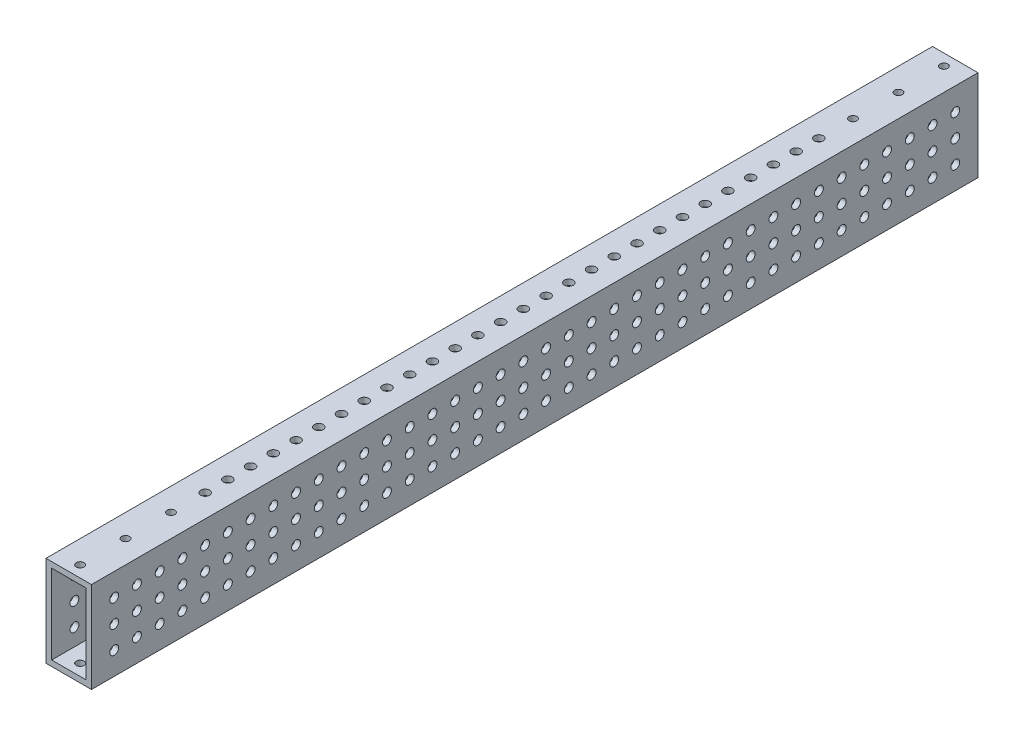
from build123d import *

# Parameters (mm, degrees)
SKETCH1_W                   = 25.4
SKETCH1_H                   = 50.8
SKETCH1_W_2                 = 19.05
SKETCH1_H_2                 = 44.45
BOSS_EXTRUDE1_DEPTH         = 247.65
SKETCH2_R                   = 2.4892
CUT_EXTRUDE1_DEPTH          = 255.079362602
LPATTERN1_COUNT             = 38
LPATTERN1_PITCH             = 12.7
SKETCH3_R                   = 2.4892
SKETCH3_R_2                 = 2.15265
CUT_EXTRUDE2_DEPTH          = 255.079362602
F_1_4_20_TAPPED_HOLE1_D     = 5.1054
F_1_4_20_TAPPED_HOLE1_DEPTH = 3.175
F_1_4_20_TAPPED_HOLE1_TIP   = 1.533816902


with BuildPart() as part:
    # Sketch1 → Boss-Extrude1 (new, symmetric)
    with BuildSketch(Plane.XY):
        with Locations((12.7, 25.4)):
            Rectangle(SKETCH1_W, SKETCH1_H)
        with Locations((12.7, 25.4)):
            Rectangle(SKETCH1_W_2, SKETCH1_H_2, mode=Mode.SUBTRACT)
    extrude(amount=BOSS_EXTRUDE1_DEPTH, both=True)

    # Sketch2 → Cut-Extrude1 (cut, through all)
    with BuildSketch(Plane.ZY):
        with Locations((-234.95, 38.1)):
            Circle(SKETCH2_R)
        with Locations((-234.95, 25.4)):
            Circle(SKETCH2_R)
        with Locations((-234.95, 12.7)):
            Circle(SKETCH2_R)
    cut_extrude1 = extrude(amount=-CUT_EXTRUDE1_DEPTH, mode=Mode.SUBTRACT)

    # LPattern1: Cut-Extrude1 ×38
    with Locations(*[(0, 0, i * LPATTERN1_PITCH) for i in range(1, LPATTERN1_COUNT)]):
        add(cut_extrude1, mode=Mode.SUBTRACT)

    # Sketch3 → Cut-Extrude2 (cut, through all)
    with BuildSketch(Plane(origin=(0, 50.8, 0), x_dir=(1, 0, 0), z_dir=(0, 1, 0))):
        with Locations(Location((12.7, 171.45, 0), (0, 0, 270))):
            Circle(SKETCH3_R)
        with Locations(Location((12.7, 158.75, 0), (0, 0, 270))):
            Circle(SKETCH3_R)
        with Locations(Location((12.7, 146.05, 0), (0, 0, 270))):
            Circle(SKETCH3_R)
        with Locations(Location((12.7, 133.35, 0), (0, 0, 270))):
            Circle(SKETCH3_R)
        with Locations(Location((12.7, 120.65, 0), (0, 0, 270))):
            Circle(SKETCH3_R)
        with Locations(Location((12.7, 107.95, 0), (0, 0, 270))):
            Circle(SKETCH3_R)
        with Locations(Location((12.7, 95.25, 0), (0, 0, 270))):
            Circle(SKETCH3_R)
        with Locations(Location((12.7, 82.55, 0), (0, 0, 270))):
            Circle(SKETCH3_R)
        with Locations(Location((12.7, 69.85, 0), (0, 0, 270))):
            Circle(SKETCH3_R)
        with Locations(Location((12.7, 57.15, 0), (0, 0, 270))):
            Circle(SKETCH3_R)
        with Locations(Location((12.7, 44.45, 0), (0, 0, 270))):
            Circle(SKETCH3_R)
        with Locations(Location((12.7, 31.75, 0), (0, 0, 270))):
            Circle(SKETCH3_R)
        with Locations(Location((12.7, 19.05, 0), (0, 0, 270))):
            Circle(SKETCH3_R)
        with Locations(Location((12.7, 6.35, 0), (0, 0, 270))):
            Circle(SKETCH3_R)
        with Locations(Location((12.7, -6.35, 0), (0, 0, 270))):
            Circle(SKETCH3_R)
        with Locations(Location((12.7, -19.05, 0), (0, 0, 270))):
            Circle(SKETCH3_R)
        with Locations(Location((12.7, -31.75, 0), (0, 0, 270))):
            Circle(SKETCH3_R)
        with Locations(Location((12.7, -44.45, 0), (0, 0, 270))):
            Circle(SKETCH3_R)
        with Locations(Location((12.7, -57.15, 0), (0, 0, 270))):
            Circle(SKETCH3_R)
        with Locations(Location((12.7, -69.85, 0), (0, 0, 270))):
            Circle(SKETCH3_R)
        with Locations(Location((12.7, -82.55, 0), (0, 0, 270))):
            Circle(SKETCH3_R)
        with Locations(Location((12.7, -95.25, 0), (0, 0, 270))):
            Circle(SKETCH3_R)
        with Locations(Location((12.7, -107.95, 0), (0, 0, 270))):
            Circle(SKETCH3_R)
        with Locations(Location((12.7, -120.65, 0), (0, 0, 270))):
            Circle(SKETCH3_R)
        with Locations(Location((12.7, -133.35, 0), (0, 0, 270))):
            Circle(SKETCH3_R)
        with Locations(Location((12.7, -146.05, 0), (0, 0, 270))):
            Circle(SKETCH3_R)
        with Locations(Location((12.7, -158.75, 0), (0, 0, 270))):
            Circle(SKETCH3_R)
        with Locations(Location((12.7, -171.45, 0), (0, 0, 270))):
            Circle(SKETCH3_R)
        with Locations(Location((12.7, 241.3, 0), (0, 0, 270))):
            Circle(SKETCH3_R_2)
        with Locations(Location((12.7, 215.9, 0), (0, 0, 270))):
            Circle(SKETCH3_R_2)
        with Locations(Location((12.7, 190.5, 0), (0, 0, 270))):
            Circle(SKETCH3_R_2)
        with Locations(Location((12.7, -241.3, 0), (0, 0, 90))):
            Circle(SKETCH3_R_2)
        with Locations(Location((12.7, -215.9, 0), (0, 0, 90))):
            Circle(SKETCH3_R_2)
        with Locations(Location((12.7, -190.5, 0), (0, 0, 90))):
            Circle(SKETCH3_R_2)
    extrude(amount=-CUT_EXTRUDE2_DEPTH, mode=Mode.SUBTRACT)

    # 1/4-20 Tapped Hole1
    with Locations(Plane(origin=(12.7, 0, -146.05), x_dir=(0, 0, -1), z_dir=(0, -1, 0))):
        with Locations((0, 0), (-292.1, 0), (-127, 0), (-165.1, 0)):
            Hole(F_1_4_20_TAPPED_HOLE1_D / 2, depth=F_1_4_20_TAPPED_HOLE1_DEPTH)
            with Locations((0, 0, -(F_1_4_20_TAPPED_HOLE1_DEPTH + F_1_4_20_TAPPED_HOLE1_TIP / 2))):  # 118° drill point
                Cone(0, F_1_4_20_TAPPED_HOLE1_D / 2, F_1_4_20_TAPPED_HOLE1_TIP, mode=Mode.SUBTRACT)


solid = part.part
